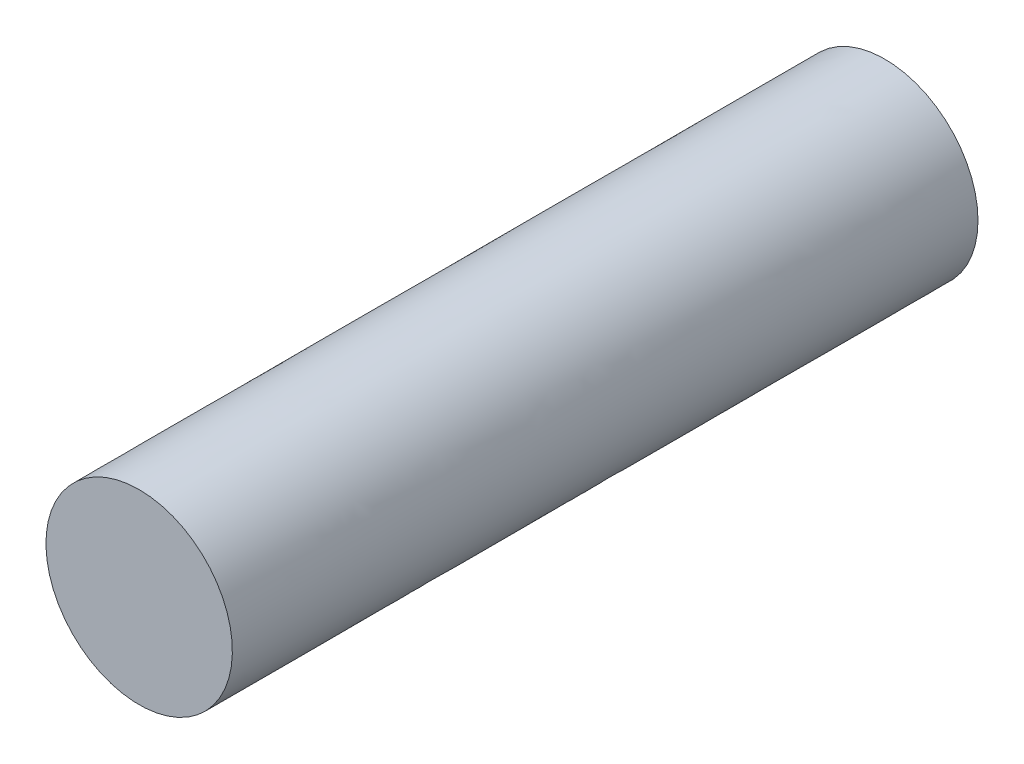
from build123d import *

# Parameters (mm, degrees)
PROFILE1_R = 5


with BuildPart() as part:
    # sweep_twist90: sweep along a path in Path1
    with BuildLine(Plane(origin=(0, 0, 0), x_dir=(0, 0, -1), z_dir=(1, 0, 0))) as sweep_twist90_path:
        Line((0, 0), (-40, 0))
    # Profile1 → sweep_twist90 (sweep)
    with BuildSketch(Plane.XY):
        Circle(PROFILE1_R)
    sweep(path=sweep_twist90_path.line)


solid = part.part
